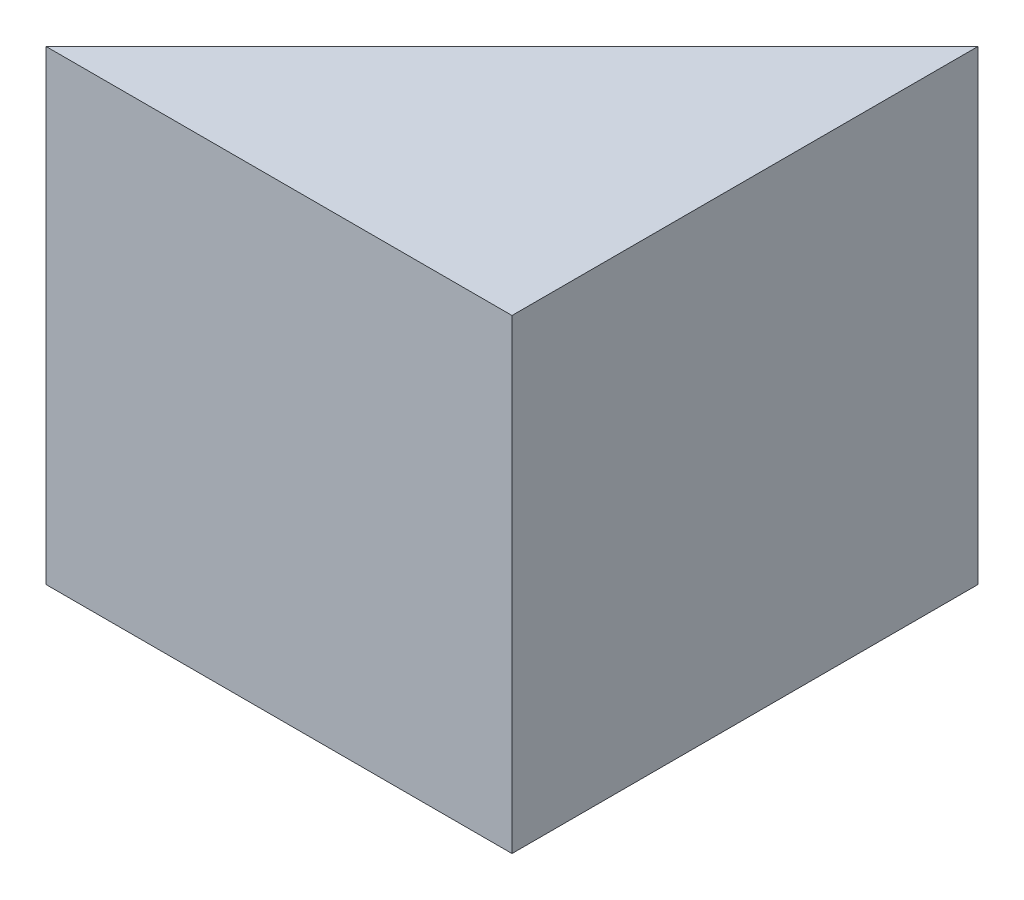
from build123d import *

# Parameters (mm, degrees)
BOSS_EXTRUDE1_DEPTH = 6.35


with BuildPart() as part:
    # Sketch1 → Boss-Extrude1 (new body)
    with BuildSketch(Plane(origin=(0, 0, 0), x_dir=(1, 0, 0), z_dir=(0, 1, 0))):
        Polygon((6.35, 6.35), (0, 0), (6.35, 0), align=None)
    extrude(amount=BOSS_EXTRUDE1_DEPTH)


solid = part.part
